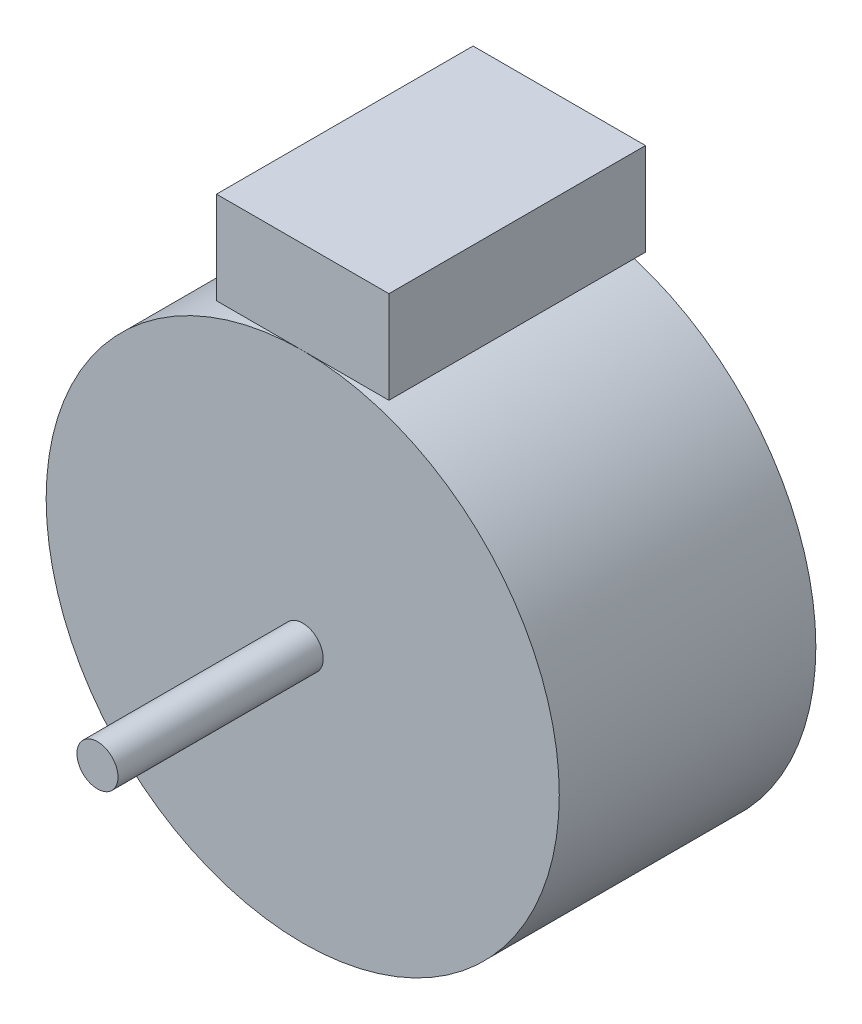
from build123d import *

# Parameters (mm, degrees)
CROQUIS3_W              = 12.5
CROQUIS3_H              = 4.5
SALIENTE_EXTRUIR1_DEPTH = 4.2


with BuildPart() as part:
    # Croquis2 → Revolución1 (revolve)
    with BuildSketch(Plane(origin=(0, 0, 0), x_dir=(0, 0, -1), z_dir=(1, 0, 0))):
        Polygon((-6.25, 0), (6.25, 0), (6.25, -12.5), (-6.25, -12.5), (-6.25, -1), (-16.25, -1), (-16.25, 0), align=None)
    revolve(axis=Axis((0, 0, 38.786408624), (0, 0, -1)))


with BuildPart() as body_2:
    # Croquis3 → Saliente-Extruir1 (new, symmetric)
    with BuildSketch(Plane(origin=(0, 0, 0), x_dir=(0, 0, -1), z_dir=(1, 0, 0))):
        with Locations((0, 14.75)):
            Rectangle(CROQUIS3_W, CROQUIS3_H)
    extrude(amount=SALIENTE_EXTRUIR1_DEPTH, both=True)


solid = Compound([part.part, body_2.part])
